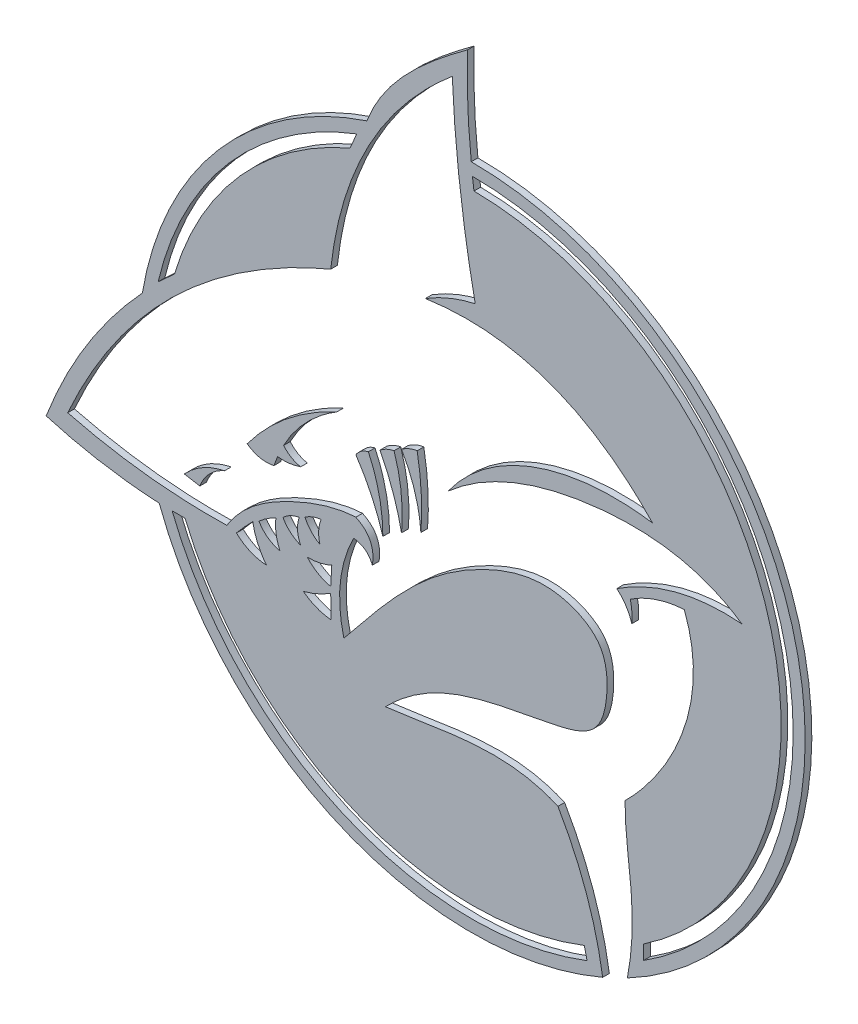
from build123d import *

# Parameters (mm, degrees)
BOSS_EXTRUDE3_DEPTH   = 10
BOSS_EXTRUDE3_2_DEPTH = 10
BOSS_EXTRUDE3_3_DEPTH = 10
BOSS_EXTRUDE3_4_DEPTH = 10
BOSS_EXTRUDE3_5_DEPTH = 10
BOSS_EXTRUDE3_6_DEPTH = 10
SCALE1_SCALE          = 0.5


with BuildPart() as part:
    # Sketch1 → Boss-Extrude3 (new body)
    with BuildSketch(Plane.XY):
        with BuildLine():
            add(Edge.make_bspline(
                [(-1263.63133239, 1098.242527418), (-1261.202140099, 1104.730272382), (-1230.93799039, 1174.485368595), (-1166.055366672, 1226.646999017), (-1112.762856025, 1265.908102727)],
                knots=[0.040886244, 0.040886244, 0.040886244, 0.040886244, 0.12800753, 1, 1, 1, 1], degree=3))
            ThreePointArc((-1263.63133239, 1098.242527418), (-1486.471083356, 949.084658682), (-1600.320027847, 706.300717173))
            add(Edge.make_bspline(
                [(-1744.525618502, 474.701031766), (-1711.302676174, 561.06431446), (-1663.234145956, 638.264209595), (-1600.320027847, 706.300717173)],
                knots=[0, 0, 0, 0, 0.971721018, 0.971721018, 0.971721018, 0.971721018], degree=3))
            add(Edge.make_bspline(
                [(-1744.525618502, 474.701031766), (-1689.187887005, 458.541122793), (-1632.682680862, 449.01606731), (-1575.010000071, 446.125865317)],
                knots=[0, 0, 0, 0, 0.976795949, 0.976795949, 0.976795949, 0.976795949], degree=3))
            ThreePointArc((-1575.010000071, 446.125865317), (-1302.977874879, 162.570432689), (-910.033769249, 162.871031787))
            add(Edge.make_bspline(
                [(-977.123176923, 351.423158012), (-925.485058478, 262.579649874), (-910.033769249, 162.871031787)],
                knots=[0, 0, 0, 0.742927266, 0.742927266, 0.742927266], degree=2))
            add(Edge.make_bspline(
                [(-1235.759996791, 351.423158012), (-1152.113670597, 361.078989104), (-1059.090958841, 387.929788965), (-977.123176923, 351.423158012)],
                knots=[0, 0, 0, 0, 1, 1, 1, 1], degree=3))
            add(Edge.make_bspline(
                [(-1298.143228869, 409.236163443), (-1253.808099637, 463.687571038), (-1192.619024152, 543.097235112), (-1085.733179826, 607.644080098), (-1018.415989197, 632.096824901), (-957.023918138, 625.421777248), (-907.129645328, 596.661928118), (-900.266201957, 537.114990722), (-914.706060361, 469.43993896), (-1061.82140305, 436.630305767), (-1161.625344375, 427.510624911), (-1235.759996791, 351.423158012)],
                knots=[0, 0, 0, 0, 0.229510077, 0.310717342, 0.401032138, 0.451947244, 0.507245641, 0.569077039, 0.631514423, 0.708424034, 1, 1, 1, 1], degree=3))
            add(Edge.make_bspline(
                [(-1283.487974001, 546.31859035), (-1316.180143245, 481.236381026), (-1298.143228869, 409.236163443)],
                knots=[0, 0, 0, 1, 1, 1], degree=2))
            add(Edge.make_bspline(
                [(-1283.487974001, 546.31859035), (-1263.116639658, 544.564724286), (-1255.418402031, 525.385350236)],
                knots=[0, 0, 0, 1, 1, 1], degree=2))
            add(Edge.make_bspline(
                [(-1280.157685801, 575.339673234), (-1249.767102626, 560.916005813), (-1255.418402031, 525.385350236)],
                knots=[0, 0, 0, 1, 1, 1], degree=2))
            add(Edge.make_bspline(
                [(-1473.681979368, 468.044630594), (-1449.357795764, 508.052491546), (-1383.111114507, 549.482671492), (-1310.797843859, 573.667273802), (-1280.157685801, 575.339673234)],
                knots=[0, 0, 0, 0, 0.599864896, 1, 1, 1, 1], degree=3))
            add(Edge.make_bspline(
                [(-1712.210400452, 494.94349492), (-1594.920512196, 465.020891229), (-1473.681979368, 468.044630594)],
                knots=[0, 0, 0, 1, 1, 1], degree=2))
            add(Edge.make_bspline(
                [(-1712.210400452, 494.94349492), (-1592.180787644, 763.277576897), (-1317.88132586, 878.50590536)],
                knots=[0, 0, 0, 1, 1, 1], degree=2))
            add(Edge.make_bspline(
                [(-1317.88132586, 878.50590536), (-1295.0122945, 1085.652772323), (-1135.578254415, 1220.126030139)],
                knots=[0, 0, 0, 1, 1, 1], degree=2))
            add(Edge.make_bspline(
                [(-1135.578254415, 1220.126030139), (-1129.513270134, 1079.708365038), (-1101.143112204, 941.996035361)],
                knots=[0, 0, 0, 1, 1, 1], degree=2))
            add(Edge.make_bspline(
                [(-1175.87972475, 911.45178862), (-1141.161580754, 933.119983699), (-1101.143112204, 941.996035361)],
                knots=[0, 0, 0, 1, 1, 1], degree=2))
            add(Edge.make_bspline(
                [(-1175.87972475, 911.45178862), (-978.317202714, 940.507647447), (-835.301807302, 790.203213883)],
                knots=[0, 0, 0, 1, 1, 1], degree=2))
            add(Edge.make_bspline(
                [(-1141.937940993, 678.267736626), (-1072.678221989, 775.442097151), (-946.866534251, 807.084244223), (-835.301807302, 790.203213883)],
                knots=[0, 0, 0, 0, 1, 1, 1, 1], degree=3))
            add(Edge.make_bspline(
                [(-1141.937940993, 678.267736626), (-1080.388995332, 732.911289537), (-928.601485639, 784.010251912), (-765.691442663, 770.620150238), (-701.362451334, 726.195681053)],
                knots=[0, 0, 0, 0, 0.514643227, 1, 1, 1, 1], degree=3))
            add(Edge.make_bspline(
                [(-701.362451334, 726.195681053), (-803.362604895, 734.292915209), (-888.866084966, 678.267736626)],
                knots=[0, 0, 0, 1, 1, 1], degree=2))
            add(Edge.make_bspline(
                [(-888.866084966, 678.267736626), (-872.512860267, 664.535590096), (-866.494655026, 643.826754071)],
                knots=[0, 0, 0, 1, 1, 1], degree=2))
            add(Edge.make_bspline(
                [(-868.625267401, 674.720633512), (-864.859299468, 659.510160585), (-866.494655026, 643.826754071)],
                knots=[0, 0, 0, 1, 1, 1], degree=2))
            add(Edge.make_bspline(
                [(-868.625267401, 674.720633512), (-832.031406061, 698.845601515), (-787.661997144, 701.708390264)],
                knots=[0, 0, 0, 1, 1, 1], degree=2))
            add(Edge.make_bspline(
                [(-787.661997144, 701.708390264), (-747.330444387, 596.951822806), (-802.45994061, 482.583896192), (-876.437512777, 409.236163443)],
                knots=[0, 0, 0, 0, 1, 1, 1, 1], degree=3))
            add(Edge.make_bspline(
                [(-876.437512777, 409.236163443), (-877.16161155, 367.340004723), (-862.172398498, 292.053808559), (-866.323385154, 214.566447875), (-873.078648853, 180.501193487)],
                knots=[0, 0, 0, 0, 0.388551219, 0.710952209, 0.710952209, 0.710952209, 0.710952209], degree=3))
            ThreePointArc((-873.078648853, 180.501193487), (-621.147379786, 743.532700181), (-1107.100081354, 1123.432441827))
            add(Edge.make_bspline(
                [(-1112.762856025, 1265.908102727), (-1114.207903254, 1218.278769927), (-1112.320311697, 1170.786882959), (-1107.100081354, 1123.432441827)],
                knots=[0, 0, 0, 0, 0.984917768, 0.984917768, 0.984917768, 0.984917768], degree=3))
        make_face()
        with BuildLine():
            ThreePointArc((-933.458971793, 172.779053053), (-1300.796022, 181.237752115), (-1555.640045516, 445.931125137))
            Line((-1555.640045516, 445.931125137), (-1536.231118978, 445.931125137))
            ThreePointArc((-1536.231118978, 445.931125137), (-1289.134463307, 195.803686174), (-937.577572517, 190.489036167))
            Line((-937.577572517, 190.489036167), (-933.458971793, 172.779053053))
        make_face(mode=Mode.SUBTRACT)
        with BuildLine():
            add(Edge.make_bspline(
                [(-1358.797626582, 439.61262453), (-1336.960261329, 445.404010525), (-1317.88132586, 457.627323247)],
                knots=[0, 0, 0, 1, 1, 1], degree=2))
            Line((-1317.88132586, 457.627323247), (-1317.181392204, 423.422199101))
            add(Edge.make_bspline(
                [(-1358.797626582, 439.61262453), (-1340.598928331, 425.480256193), (-1317.181392204, 423.422199101)],
                knots=[0, 0, 0, 1, 1, 1], degree=2))
        make_face(mode=Mode.SUBTRACT)
        with BuildLine():
            add(Edge.make_bspline(
                [(-1459.194583088, 465.341602265), (-1440.418241827, 447.658662895), (-1414.071525869, 445.931125137)],
                knots=[0, 0, 0, 1, 1, 1], degree=2))
            add(Edge.make_bspline(
                [(-1459.194583088, 465.341602265), (-1447.618648245, 479.415011478), (-1434.74242359, 492.314602949)],
                knots=[0, 0, 0, 1, 1, 1], degree=2))
            add(Edge.make_bspline(
                [(-1434.74242359, 492.314602949), (-1430.308134563, 466.635297777), (-1414.071525869, 445.931125137)],
                knots=[0, 0, 0, 1, 1, 1], degree=2))
        make_face(mode=Mode.SUBTRACT)
        with BuildLine():
            add(Edge.make_bspline(
                [(-1425.444568717, 497.452638802), (-1414.791052456, 479.582679223), (-1393.838312351, 474.701031766)],
                knots=[0, 0, 0, 1, 1, 1], degree=2))
            add(Edge.make_bspline(
                [(-1425.444568717, 497.452638802), (-1414.192890512, 507.892653871), (-1400.090099324, 514.124070732)],
                knots=[0, 0, 0, 1, 1, 1], degree=2))
            add(Edge.make_bspline(
                [(-1400.090099324, 514.124070732), (-1402.652543881, 493.654889152), (-1393.838312351, 474.701031766)],
                knots=[0, 0, 0, 1, 1, 1], degree=2))
        make_face(mode=Mode.SUBTRACT)
        with BuildLine():
            add(Edge.make_bspline(
                [(-1352.951903874, 487.082821292), (-1333.807525045, 486.7822803), (-1316.288492525, 494.94349492)],
                knots=[0, 0, 0, 1, 1, 1], degree=2))
            Line((-1316.288492525, 494.94349492), (-1317.88132586, 466.542868714))
            add(Edge.make_bspline(
                [(-1352.951903874, 487.082821292), (-1338.846640676, 471.31662317), (-1317.88132586, 466.542868714)],
                knots=[0, 0, 0, 1, 1, 1], degree=2))
        make_face(mode=Mode.SUBTRACT)
        with BuildLine():
            add(Edge.make_bspline(
                [(-1389.507092136, 520.384110498), (-1380.373466963, 504.458260755), (-1362.948146519, 497.452638802)],
                knots=[0, 0, 0, 1, 1, 1], degree=2))
            add(Edge.make_bspline(
                [(-1389.507092136, 520.384110498), (-1379.113523299, 530.129371625), (-1364.981939651, 532.826139075)],
                knots=[0, 0, 0, 1, 1, 1], degree=2))
            add(Edge.make_bspline(
                [(-1364.981939651, 532.826139075), (-1371.323314758, 514.821721218), (-1362.948146519, 497.452638802)],
                knots=[0, 0, 0, 1, 1, 1], degree=2))
        make_face(mode=Mode.SUBTRACT)
        with BuildLine():
            add(Edge.make_bspline(
                [(-1356.359373357, 537.168901614), (-1349.28319577, 521.544306014), (-1334.018627165, 513.115913277)],
                knots=[0, 0, 0, 1, 1, 1], degree=2))
            add(Edge.make_bspline(
                [(-1356.359373357, 537.168901614), (-1345.584391479, 544.979511684), (-1332.127347064, 546.31859035)],
                knots=[0, 0, 0, 1, 1, 1], degree=2))
            add(Edge.make_bspline(
                [(-1332.127347064, 546.31859035), (-1338.770997668, 530.212076305), (-1334.018627165, 513.115913277)],
                knots=[0, 0, 0, 1, 1, 1], degree=2))
        make_face(mode=Mode.SUBTRACT)
        with BuildLine():
            Line((-848.720702162, 215.409358551), (-848.720702162, 236.884079943))
            ThreePointArc((-848.720702162, 236.884079943), (-661.883498729, 756.057076392), (-1103.074255056, 1087.417088103))
            Line((-1103.074255056, 1087.417088103), (-1105.358251581, 1105.430169568))
            ThreePointArc((-1105.358251581, 1105.430169568), (-643.298767355, 756.653915858), (-848.720702162, 215.409358551))
        make_face(mode=Mode.SUBTRACT)
        with BuildLine():
            ThreePointArc((-1576.651704851, 732.749261972), (-1470.175074093, 940.405394173), (-1278.69175605, 1073.793853377))
            Line((-1278.69175605, 1073.793853377), (-1288.992428252, 1050.230108249))
            ThreePointArc((-1288.992428252, 1050.230108249), (-1453.534001385, 932.058901631), (-1552.121192216, 755.0873526))
            Line((-1552.121192216, 755.0873526), (-1576.651704851, 732.749261972))
        make_face(mode=Mode.SUBTRACT)
    extrude(amount=BOSS_EXTRUDE3_DEPTH)


with BuildPart() as body_2:
    # Sketch1 → Boss-Extrude3 2 (new body)
    with BuildSketch(Plane.XY):
        with BuildLine():
            add(Edge.make_bspline(
                [(-1280.157685801, 656.518231076), (-1253.399487346, 616.758220262), (-1239.671155208, 570.582118663)],
                knots=[0, 0, 0, 1, 1, 1], degree=2))
            add(Edge.make_bspline(
                [(-1239.671155208, 570.582118663), (-1239.515684666, 622.734579057), (-1261.398966338, 669.706630488)],
                knots=[0, 0, 0, 1, 1, 1], degree=2))
            add(Edge.make_bspline(
                [(-1261.398966338, 669.706630488), (-1273.379904272, 666.774628033), (-1280.157685801, 656.518231076)],
                knots=[0, 0, 0, 1, 1, 1], degree=2))
        make_face()
    extrude(amount=BOSS_EXTRUDE3_2_DEPTH)


with BuildPart() as body_3:
    # Sketch1 → Boss-Extrude3 3 (new body)
    with BuildSketch(Plane.XY):
        with BuildLine():
            add(Edge.make_bspline(
                [(-1243.957385017, 680.587060002), (-1234.620506297, 687.959275802), (-1222.855945959, 690.345124263)],
                knots=[0, 0, 0, 1, 1, 1], degree=2))
            add(Edge.make_bspline(
                [(-1243.957385017, 680.587060002), (-1221.490315516, 637.212379982), (-1211.645806459, 589.257394078)],
                knots=[0, 0, 0, 1, 1, 1], degree=2))
            add(Edge.make_bspline(
                [(-1222.855945959, 690.345124263), (-1206.823456635, 641.212527328), (-1211.645806459, 589.257394078)],
                knots=[0, 0, 0, 1, 1, 1], degree=2))
        make_face()
    extrude(amount=BOSS_EXTRUDE3_3_DEPTH)


with BuildPart() as body_4:
    # Sketch1 → Boss-Extrude3 4 (new body)
    with BuildSketch(Plane.XY):
        with BuildLine():
            add(Edge.make_bspline(
                [(-1211.645806459, 697.731979237), (-1201.130523999, 705.671874083), (-1188.236397504, 707.585111936)],
                knots=[0, 0, 0, 1, 1, 1], degree=2))
            add(Edge.make_bspline(
                [(-1211.645806459, 697.731979237), (-1186.293104758, 654.702094909), (-1182.631327754, 604.216577494)],
                knots=[0, 0, 0, 1, 1, 1], degree=2))
            add(Edge.make_bspline(
                [(-1188.236397504, 707.585111936), (-1178.700029916, 656.339825546), (-1182.631327754, 604.216577494)],
                knots=[0, 0, 0, 1, 1, 1], degree=2))
        make_face()
    extrude(amount=BOSS_EXTRUDE3_4_DEPTH)


with BuildPart() as body_5:
    # Sketch1 → Boss-Extrude3 5 (new body)
    with BuildSketch(Plane.XY):
        with BuildLine():
            add(Edge.make_bspline(
                [(-1443.061199502, 589.257394078), (-1390.429785543, 660.129770189), (-1308.721814529, 697.731979237)],
                knots=[0, 0, 0, 1, 1, 1], degree=2))
            add(Edge.make_bspline(
                [(-1443.061199502, 589.257394078), (-1424.992416527, 576.185587951), (-1402.934287541, 580.974530388)],
                knots=[0, 0, 0, 1, 1, 1], degree=2))
            add(Edge.make_bspline(
                [(-1402.934287541, 580.974530388), (-1400.418570919, 588.297073791), (-1397.501810539, 595.299217154)],
                knots=[0, 0, 0, 0.097199592, 0.097199592, 0.097199592], degree=2))
            add(Edge.make_bspline(
                [(-1362.948146519, 599.331253165), (-1374.2470068, 595.401959585), (-1385.764894806, 594.057947581), (-1397.501810539, 595.299217154)],
                knots=[0, 0, 0, 0, 0.73124898, 0.73124898, 0.73124898, 0.73124898], degree=3))
            add(Edge.make_bspline(
                [(-1362.948146519, 599.331253165), (-1373.351683432, 601.434188375), (-1381.860849453, 606.462110923), (-1388.475644055, 614.415021792)],
                knots=[0, 0, 0, 0, 0.772086951, 0.772086951, 0.772086951, 0.772086951], degree=3))
            add(Edge.make_bspline(
                [(-1388.475644055, 614.415021792), (-1370.186820053, 648.814974217), (-1343.602210211, 676.587293365), (-1308.721814529, 697.731979237)],
                knots=[0.234301081, 0.234301081, 0.234301081, 0.234301081, 1, 1, 1, 1], degree=3))
        make_face()
    extrude(amount=BOSS_EXTRUDE3_5_DEPTH)


with BuildPart() as body_6:
    # Sketch1 → Boss-Extrude3 6 (new body)
    with BuildSketch(Plane.XY):
        with BuildLine():
            add(Edge.make_bspline(
                [(-1537.358631206, 502.873214512), (-1513.076188134, 529.486574145), (-1477.045313421, 537.168901614)],
                knots=[0, 0, 0, 1, 1, 1], degree=2))
            add(Edge.make_bspline(
                [(-1537.358631206, 502.873214512), (-1525.742346148, 500.732685683), (-1514.07591662, 498.881892012)],
                knots=[0, 0, 0, 1, 1, 1], degree=2))
            add(Edge.make_bspline(
                [(-1514.07591662, 498.881892012), (-1503.832488556, 525.507397596), (-1477.045313421, 537.168901614)],
                knots=[0, 0, 0, 1, 1, 1], degree=2))
        make_face()
    extrude(amount=BOSS_EXTRUDE3_6_DEPTH)


with BuildPart() as part_1:
    # Scale1: scaled about (0, 0, 0)
    add(part.part.scale(SCALE1_SCALE))


with BuildPart() as body_2_1:
    # Scale1: scaled about (0, 0, 0)
    add(body_2.part.scale(SCALE1_SCALE))


with BuildPart() as body_3_1:
    # Scale1: scaled about (0, 0, 0)
    add(body_3.part.scale(SCALE1_SCALE))


with BuildPart() as body_4_1:
    # Scale1: scaled about (0, 0, 0)
    add(body_4.part.scale(SCALE1_SCALE))


with BuildPart() as body_5_1:
    # Scale1: scaled about (0, 0, 0)
    add(body_5.part.scale(SCALE1_SCALE))


with BuildPart() as body_6_1:
    # Scale1: scaled about (0, 0, 0)
    add(body_6.part.scale(SCALE1_SCALE))


solid = Compound([part_1.part, body_2_1.part, body_3_1.part, body_4_1.part, body_5_1.part, body_6_1.part])
